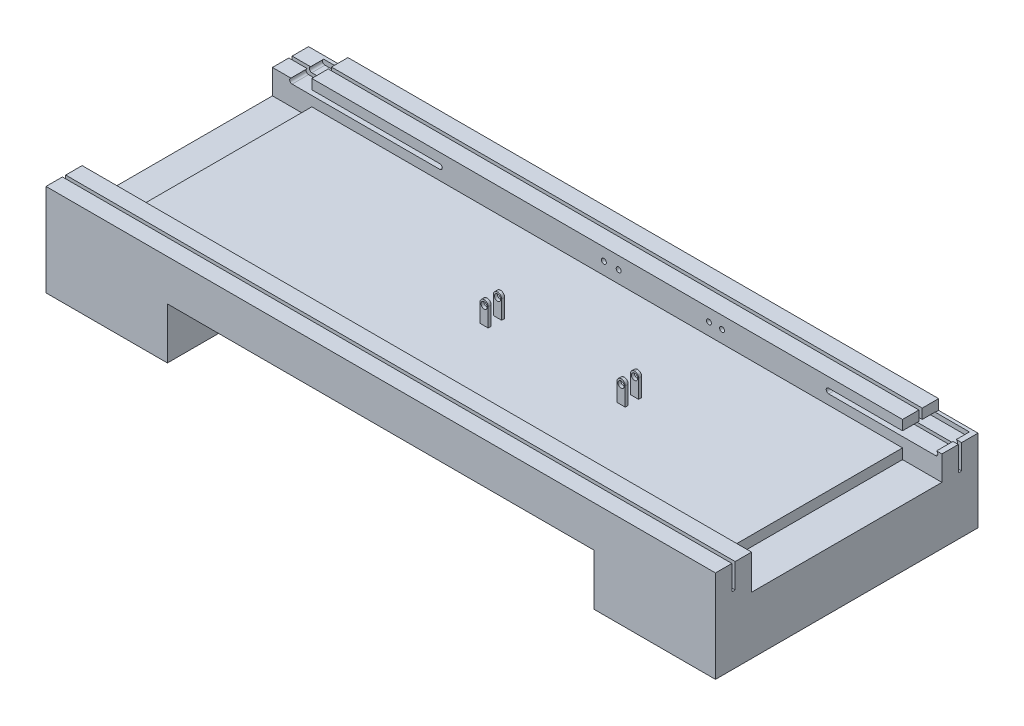
from build123d import *

# Parameters (mm, degrees)
GENERAL_SHAPE_DEPTH      = 800
SKETCH5_W                = 1800
SKETCH5_H                = 700
CUT_EXTRUDE2_DEPTH       = 75
SKETCH6_W                = 1300
SKETCH6_H                = 156.02
WEIGHT_REDUCTION_DEPTH   = 1223.94273789
BOSS_EXTRUDE3_DEPTH      = 900
BOSS_EXTRUDE3_DEPTH_BACK = 900
SKETCH8_W                = 50
SKETCH8_H                = 75
BOSS_EXTRUDE4_DEPTH      = 120
BOSS_EXTRUDE5_DEPTH      = 120
CUT_EXTRUDE4_DEPTH       = 740
CUT_EXTRUDE4_DEPTH_BACK  = 40
SKETCH7_R                = 7.5
BOSS_EXTRUDE6_DEPTH      = 25
BOSS_EXTRUDE6_DEPTH_BACK = 25
SKETCH12_R               = 9.525
SKETCH13_W               = 31.75
SKETCH13_H               = 68.5
CUT_EXTRUDE5_DEPTH       = 1371.819167563


with BuildPart() as part:
    # Sketch1 → General shape (new body)
    with BuildSketch(Plane.XY):
        Polygon((-900, 213.515667244), (900, 213.515667244), (900, -67.504332756), (500, -67.504332756), (-500, -67.504332756), (-900, -67.504332756), align=None)
    extrude(amount=GENERAL_SHAPE_DEPTH)

    # Sketch5 → Cut-Extrude2 (cut)
    with BuildSketch(Plane(origin=(0, 213.515667244, 0), x_dir=(1, 0, 0), z_dir=(0, 1, 0))):
        with Locations((0, -400)):
            Rectangle(SKETCH5_W, SKETCH5_H)
    extrude(amount=-CUT_EXTRUDE2_DEPTH, mode=Mode.SUBTRACT)

    # Sketch6 → Weight reduction (cut, through all)
    with BuildSketch(Plane(origin=(0, 0, 0), x_dir=(-1, 0, 0), z_dir=(0, 0, -1))):
        with Locations((0, 10.505667244)):
            Rectangle(SKETCH6_W, SKETCH6_H)
    extrude(amount=-WEIGHT_REDUCTION_DEPTH, mode=Mode.SUBTRACT)

    # Sketch8 → Boss-Extrude3 (add, two sides: drawn at the far end of the back side and taken through both)
    with BuildSketch(Plane(origin=(0, 0, 0), x_dir=(0, 0, -1), z_dir=(1, 0, 0)).offset(-BOSS_EXTRUDE3_DEPTH_BACK)):
        with Locations((-715, 176.015667244)):
            Rectangle(SKETCH8_W, SKETCH8_H)
        with Locations((-85, 176.015667244)):
            Rectangle(SKETCH8_W, SKETCH8_H)
    extrude(amount=BOSS_EXTRUDE3_DEPTH + BOSS_EXTRUDE3_DEPTH_BACK)

    # Sketch9 → Boss-Extrude4 (add)
    with BuildSketch(Plane(origin=(900, 0, 0), x_dir=(0, 0, -1), z_dir=(1, 0, 0))):
        Polygon((-800, 213.515667244), (-750, 213.515667244), (-750, 138.515667244), (-740, 138.515667244), (-740, 213.515667244), (-690, 213.515667244), (-690, 107.495667244), (-110, 107.495667244), (-110, 182.495667244), (-60, 182.495667244), (-60, 107.495667244), (-50, 107.495667244), (-50, 182.495667244), (0, 182.495667244), (0, -67.504332756), (-800, -67.504332756), align=None)
    extrude(amount=BOSS_EXTRUDE4_DEPTH)

    # Sketch10 → Boss-Extrude5 (add)
    with BuildSketch(Plane.ZY.offset(900)):
        Polygon((800, 213.515667244), (750, 213.515667244), (750, 138.515667244), (740, 138.515667244), (740, 213.515667244), (690, 213.515667244), (690, 107.495667244), (110, 107.495667244), (110, 182.495667244), (60, 182.495667244), (60, 107.495667244), (50, 107.495667244), (50, 182.495667244), (0, 182.495667244), (0, -67.504332756), (800, -67.504332756), align=None)
    extrude(amount=BOSS_EXTRUDE5_DEPTH)

    # Sketch7 → Cut-Extrude4 (cut, two sides: drawn at the far end of the back side and taken through both)
    with BuildSketch(Plane(origin=(0, 0, 750), x_dir=(-1, 0, 0), z_dir=(0, 0, -1)).offset(-CUT_EXTRUDE4_DEPTH_BACK)):
        with Locations(Location((-35, 176.015667244, 0), (0, 0, 180))):
            Circle(SKETCH7_R)
        with Locations(Location((-350, 176.015667244, 0), (0, 0, 180))):
            Circle(SKETCH7_R)
        with Locations(Location((-310, 176.015667244, 0), (0, 0, 180))):
            Circle(SKETCH7_R)
        with Locations(Location((10, 176.015667244, 0), (0, 0, 180))):
            Circle(SKETCH7_R)
        with BuildLine():
            Line((960, 168.515667244), (510, 168.515667244))
            ThreePointArc((510, 168.515667244), (502.5, 176.015667244), (510, 183.515667244))
            Line((510, 183.515667244), (960, 183.515667244))
            ThreePointArc((960, 183.515667244), (967.5, 176.015667244), (960, 168.515667244))
        make_face()
        with BuildLine():
            Line((-1000, 183.515667244), (-675, 183.515667244))
            ThreePointArc((-675, 183.515667244), (-667.5, 176.015667244), (-675, 168.515667244))
            Line((-675, 168.515667244), (-1000, 168.515667244))
            ThreePointArc((-1000, 168.515667244), (-1007.5, 176.015667244), (-1000, 183.515667244))
        make_face()
    extrude(amount=CUT_EXTRUDE4_DEPTH + CUT_EXTRUDE4_DEPTH_BACK, mode=Mode.SUBTRACT)

    # Sketch12 → Boss-Extrude6 (add, two sides: drawn at the far end of the back side and taken through both)
    # profile 1 of 2: a face of its own
    with BuildSketch(Plane(origin=(0, 0, 400), x_dir=(-1, 0, 0), z_dir=(0, 0, -1)).offset(-BOSS_EXTRUDE6_DEPTH_BACK)):
        with BuildLine():
            Line((72.5, 138.515667244), (72.5, 194.615667244))
            ThreePointArc((72.5, 194.615667244), (68.868124087, 203.383791331), (60.1, 207.015667244))
            Line((60.1, 207.015667244), (59.9, 207.015667244))
            ThreePointArc((59.9, 207.015667244), (51.131875913, 203.383791331), (47.5, 194.615667244))
            Line((47.5, 194.615667244), (47.5, 138.515667244))
            Line((47.5, 138.515667244), (72.5, 138.515667244))
        make_face()
        with Locations((60, 192.015667244)):
            Circle(SKETCH12_R, mode=Mode.SUBTRACT)
    # profile 2 of 2: a face of its own
    with BuildSketch(Plane(origin=(0, 0, 400), x_dir=(-1, 0, 0), z_dir=(0, 0, -1)).offset(-BOSS_EXTRUDE6_DEPTH_BACK)):
        with BuildLine():
            Line((-345, 138.515667244), (-345, 194.615667244))
            ThreePointArc((-345, 194.615667244), (-348.631875913, 203.383791331), (-357.4, 207.015667244))
            Line((-357.4, 207.015667244), (-357.6, 207.015667244))
            ThreePointArc((-357.6, 207.015667244), (-366.368124087, 203.383791331), (-370, 194.615667244))
            Line((-370, 194.615667244), (-370, 138.515667244))
            Line((-370, 138.515667244), (-345, 138.515667244))
        make_face()
        with Locations((-357.5, 192.015667244)):
            Circle(SKETCH12_R, mode=Mode.SUBTRACT)
    extrude(amount=BOSS_EXTRUDE6_DEPTH + BOSS_EXTRUDE6_DEPTH_BACK)

    # Sketch13 → Cut-Extrude5 (cut, through all)
    with BuildSketch(Plane.ZY.offset(72.5)):
        with Locations((400, 172.765667244)):
            Rectangle(SKETCH13_W, SKETCH13_H)
    extrude(amount=-CUT_EXTRUDE5_DEPTH, mode=Mode.SUBTRACT)


solid = part.part
